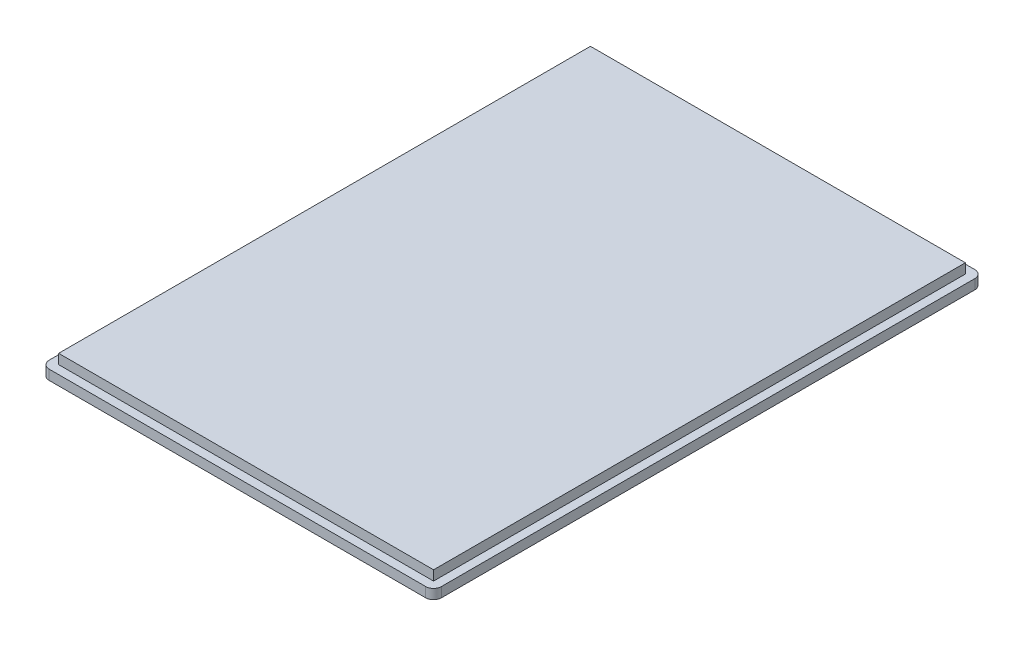
from build123d import *

# Parameters (mm, degrees)
SKETCH1_W           = 127
SKETCH1_H           = 177.8
BOSS_EXTRUDE1_DEPTH = 3.175
FILLET1_R           = 2.54
SKETCH2_W           = 121.412
SKETCH2_H           = 172.212
BOSS_EXTRUDE2_DEPTH = 3.175


with BuildPart() as part:
    # Sketch1 → Boss-Extrude1 (new body)
    with BuildSketch(Plane(origin=(0, 0, 0), x_dir=(1, 0, 0), z_dir=(0, 1, 0))):
        with Locations((63.5, 88.9)):
            Rectangle(SKETCH1_W, SKETCH1_H)
    extrude(amount=BOSS_EXTRUDE1_DEPTH)

    # Fillet1
    fillet1_edges = [part.edges().sort_by_distance(p)[0] for p in [
        (0, 1.5875, -177.8),
        (127, 1.5875, -177.8),
        (127, 1.5875, 0),
        (0, 1.5875, 0),
    ]]
    fillet(fillet1_edges, radius=FILLET1_R)

    # Sketch2 → Boss-Extrude2 (add)
    with BuildSketch(Plane(origin=(0, 3.175, 0), x_dir=(1, 0, 0), z_dir=(0, 1, 0))):
        with Locations((63.5, 88.9)):
            Rectangle(SKETCH2_W, SKETCH2_H)
    extrude(amount=BOSS_EXTRUDE2_DEPTH)


solid = part.part
